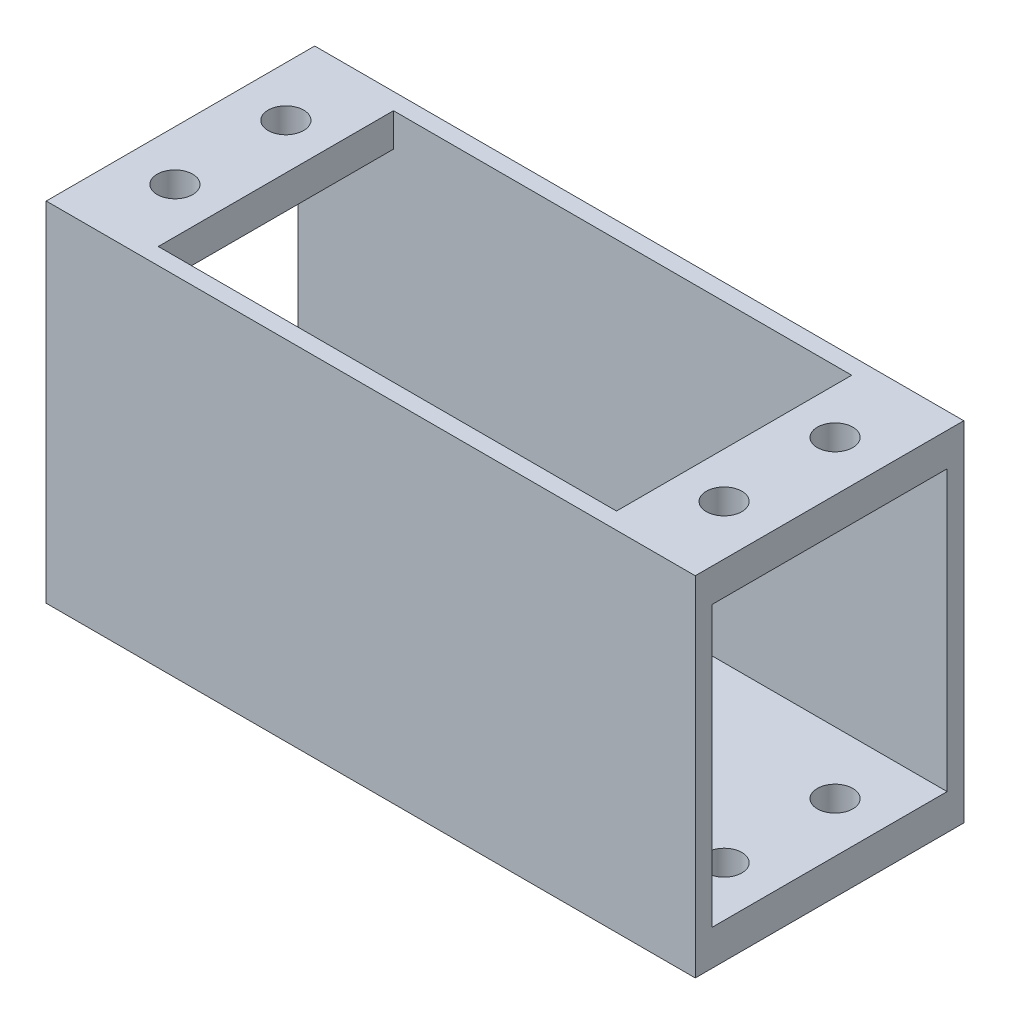
from build123d import *

# Parameters (mm, degrees)
CHANNEL_DEPTH             = 39.35
CHANNEL_DEPTH_BACK        = 19.15
FLANGES_SKETCH_W          = 8.6
FLANGES_SKETCH_H          = 3
FLANGES_DEPTH             = 10.6
SERVO_HOLES_SKETCH_R      = 1.6
SERVO_HOLES_DEPTH         = 51.2
PANEL_HOLE_SKETCH_R       = 7.7
PANEL_HOLE_DEPTH          = 14
PANEL_NUT_RELIEF_SKETCH_W = 11.5
PANEL_NUT_RELIEF_SKETCH_H = 5


with BuildPart() as part:
    # Channel Sketch → Channel (new, two sides: drawn at the far end of the back side and taken through both)
    with BuildSketch(Plane(origin=(0, 0, 0), x_dir=(0, 0, -1), z_dir=(1, 0, 0)).offset(-CHANNEL_DEPTH_BACK)):
        Polygon((-12.1, 9.8), (12.1, 9.8), (12.1, 41.2), (10.6, 41.2), (10.6, 13), (-10.6, 13), (-10.6, 41.2), (-12.1, 41.2), align=None)
    extrude(amount=CHANNEL_DEPTH + CHANNEL_DEPTH_BACK)

    # Flanges Sketch → Flanges (add, symmetric)
    with BuildSketch(Plane.XY):
        with Locations((-14.85, 39.7)):
            Rectangle(FLANGES_SKETCH_W, FLANGES_SKETCH_H)
        with Locations((35.05, 39.7)):
            Rectangle(FLANGES_SKETCH_W, FLANGES_SKETCH_H)
    extrude(amount=FLANGES_DEPTH, both=True)

    # Servo Holes Sketch → Servo Holes (cut, symmetric)
    with BuildSketch(Plane(origin=(0, 0, 0), x_dir=(1, 0, 0), z_dir=(0, 1, 0))):
        with Locations((-14.65, -5)):
            Circle(SERVO_HOLES_SKETCH_R)
        with Locations((-14.65, 5)):
            Circle(SERVO_HOLES_SKETCH_R)
        with Locations((34.85, -5)):
            Circle(SERVO_HOLES_SKETCH_R)
        with Locations((34.85, 5)):
            Circle(SERVO_HOLES_SKETCH_R)
    extrude(amount=SERVO_HOLES_DEPTH, both=True, mode=Mode.SUBTRACT)

    # Panel Hole Sketch → Panel Hole (cut, symmetric)
    with BuildSketch(Plane(origin=(0, 0, 0), x_dir=(1, 0, 0), z_dir=(0, 1, 0))):
        Circle(PANEL_HOLE_SKETCH_R)
    extrude(amount=PANEL_HOLE_DEPTH, both=True, mode=Mode.SUBTRACT)

    # Panel Nut Relief Sketch → Panel Nut Relief (revolve, cut)
    with BuildSketch(Plane.XY):
        with Locations((5.75, 15.5)):
            Rectangle(PANEL_NUT_RELIEF_SKETCH_W, PANEL_NUT_RELIEF_SKETCH_H)
    revolve(axis=Axis((0, -500, 0), (0, 1, 0)), mode=Mode.SUBTRACT)


solid = part.part
